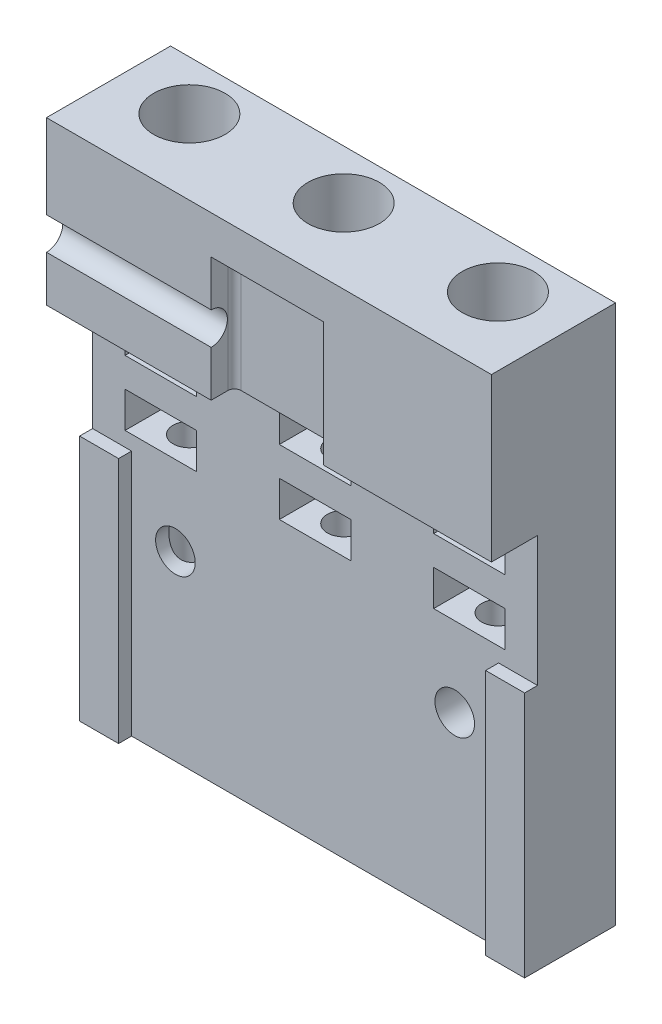
from build123d import *

# Parameters (mm, degrees)
ESQUISSE2_W                  = 56.5
ESQUISSE2_H                  = 38
ESQUISSE2_R                  = 3.05
ESQUISSE2_W_2                = 6
SOCLESYRINGE_DEPTH           = 12
ESQUISSE2_2_R                = 3.05
BOSS_EXTRU_2_DEPTH           = 3
ESQUISSE2_4_W                = 6
ESQUISSE2_4_H                = 38
BOSS_EXTRU_4_DEPTH           = 14
ESQUISSE3_W                  = 68.5
ESQUISSE3_H                  = 20
BOSS_EXTRU_3_DEPTH           = 12
ESQUISSE4_W                  = 11
ESQUISSE4_H                  = 5.5
ENL_V_MAT_EXTRU_1_DEPTH      = 10
CONG_1_R                     = 2.7
ESQUISSE6_W                  = 68.5
ESQUISSE6_H                  = 25
BOSS_EXTRU_5_DEPTH           = 15.5
BOSS_EXTRU_6_DEPTH           = 3.6
ENL_V_MAT_EXTRU_3_DEPTH      = 80.515611675
CONG_2_R                     = 1
ENL_V_MAT_EXTRU_2_DEPTH      = 76.059126694
ENL_V_MAT_EXTRU_2_DEPTH_BACK = 76.059126694
ESQUISSE5_R                  = 2.5
ESQUISSE9_R                  = 5.5
ENL_V_MAT_EXTRU_4_DEPTH      = 24


with BuildPart() as part:
    # Esquisse2 → SocleSyringe (new body)
    # profile 1 of 3: a face of its own
    with BuildSketch(Plane.XY):
        Rectangle(ESQUISSE2_W, ESQUISSE2_H)
        with Locations((-21.5, 9)):
            Circle(ESQUISSE2_R, mode=Mode.SUBTRACT)
        with Locations((21.5, 9)):
            Circle(ESQUISSE2_R, mode=Mode.SUBTRACT)
    # profile 2 of 3: a face of its own
    with BuildSketch(Plane.XY):
        with Locations((-31.25, 0)):
            Rectangle(ESQUISSE2_W_2, ESQUISSE2_H)
    # profile 3 of 3: a face of its own
    with BuildSketch(Plane.XY):
        with Locations((31.25, 0)):
            Rectangle(ESQUISSE2_W_2, ESQUISSE2_H)
    extrude(amount=SOCLESYRINGE_DEPTH)

    # Esquisse2<2> → Boss.-Extru.2 (add)
    with BuildSketch(Plane.XY):
        with Locations((-21.5, 9)):
            Circle(ESQUISSE2_2_R)
        with Locations((21.5, 9)):
            Circle(ESQUISSE2_2_R)
    extrude(amount=BOSS_EXTRU_2_DEPTH)

    # Esquisse2<4> → Boss.-Extru.4 (add)
    with BuildSketch(Plane.XY):
        with Locations((-31.25, 0)):
            Rectangle(ESQUISSE2_4_W, ESQUISSE2_4_H)
        with Locations((31.25, 0)):
            Rectangle(ESQUISSE2_4_W, ESQUISSE2_4_H)
    extrude(amount=BOSS_EXTRU_4_DEPTH)

    # Esquisse3 → Boss.-Extru.3 (add)
    with BuildSketch(Plane.XY):
        with Locations((0, 29)):
            Rectangle(ESQUISSE3_W, ESQUISSE3_H)
    extrude(amount=BOSS_EXTRU_3_DEPTH)

    # Esquisse4 → Enlèv. mat.-Extru.1 (cut)
    with BuildSketch(Plane.XY.offset(12)):
        with Locations((-23.75, 34)):
            Rectangle(ESQUISSE4_W, ESQUISSE4_H)
        with Locations((23.75, 34)):
            Rectangle(ESQUISSE4_W, ESQUISSE4_H)
        with Locations((23.75, 24)):
            Rectangle(ESQUISSE4_W, ESQUISSE4_H)
        with Locations((-23.75, 24)):
            Rectangle(ESQUISSE4_W, ESQUISSE4_H)
        with Locations((0, 34)):
            Rectangle(ESQUISSE4_W, ESQUISSE4_H)
        with Locations((0, 24)):
            Rectangle(ESQUISSE4_W, ESQUISSE4_H)
    extrude(amount=-ENL_V_MAT_EXTRU_1_DEPTH, mode=Mode.SUBTRACT)

    # Congé1
    cong_1_edges = [part.edges().sort_by_distance(p)[0] for p in [
        (23.75, 36.75, 2),
        (23.75, 31.25, 2),
        (23.75, 26.75, 2),
        (23.75, 21.25, 2),
        (-23.75, 21.25, 2),
        (-23.75, 26.75, 2),
        (0, 31.25, 2),
        (0, 36.75, 2),
        (0, 21.25, 2),
        (0, 26.75, 2),
        (-23.75, 31.25, 2),
        (-23.75, 36.75, 2),
    ]]
    fillet(cong_1_edges, radius=CONG_1_R)

    # Esquisse6 → Boss.-Extru.5 (add)
    with BuildSketch(Plane.XY):
        with Locations((0, 51.5)):
            Rectangle(ESQUISSE6_W, ESQUISSE6_H)
    extrude(amount=BOSS_EXTRU_5_DEPTH)

    # Esquisse7 → Boss.-Extru.6 (add)
    with BuildSketch(Plane.XY.offset(15.5)):
        Polygon((-34.25, 39), (-8.9, 39), (-8.9, 58.1), (0, 58.1), (0, 64), (-34.25, 64), align=None)
        Polygon((8.4, 58.1), (8.4, 39), (34.25, 39), (34.25, 64), (0, 64), (0, 58.1), align=None)
    extrude(amount=BOSS_EXTRU_6_DEPTH)

    # Esquisse8 → Enlèv. mat.-Extru.3 (cut, through all)
    with BuildSketch(Plane(origin=(-8.9, 0, 0), x_dir=(0, 0, -1), z_dir=(1, 0, 0))):
        with BuildLine():
            Line((-19.1, 51.05), (-19.1, 46.05))
            ThreePointArc((-19.1, 46.05), (-16.6, 48.55), (-19.1, 51.05))
        make_face()
    extrude(amount=-ENL_V_MAT_EXTRU_3_DEPTH, mode=Mode.SUBTRACT)

    # Congé2
    cong_2_edges = [part.edges().sort_by_distance(p)[0] for p in [
        (-8.9, 48.55, 15.5),
        (8.4, 48.55, 15.5),
    ]]
    fillet(cong_2_edges, radius=CONG_2_R)

    # Esquisse5 → Enlèv. mat.-Extru.2 (cut, two sides: drawn at the far end of the back side and taken through both)
    with BuildSketch(Plane(origin=(0, 0, 0), x_dir=(1, 0, 0), z_dir=(0, 1, 0)).offset(-ENL_V_MAT_EXTRU_2_DEPTH_BACK)):
        with Locations(Location((23.75, -7.6, 0), (0, 0, 270))):
            Circle(ESQUISSE5_R)
        with Locations((-23.75, -7.6)):
            Circle(ESQUISSE5_R)
        with Locations(Location((0, -7.6, 0), (0, 0, 90))):
            Circle(ESQUISSE5_R)
    extrude(amount=ENL_V_MAT_EXTRU_2_DEPTH + ENL_V_MAT_EXTRU_2_DEPTH_BACK, mode=Mode.SUBTRACT)

    # Esquisse9 → Enlèv. mat.-Extru.4 (cut)
    with BuildSketch(Plane(origin=(0, 64, 0), x_dir=(1, 0, 0), z_dir=(0, 1, 0))):
        with Locations(Location((-23.75, -7.6, 0), (0, 0, 270))):
            Circle(ESQUISSE9_R)
        with Locations(Location((0, -7.6, 0), (0, 0, 270))):
            Circle(ESQUISSE9_R)
        with Locations(Location((23.75, -7.6, 0), (0, 0, 270))):
            Circle(ESQUISSE9_R)
    extrude(amount=-ENL_V_MAT_EXTRU_4_DEPTH, mode=Mode.SUBTRACT)


solid = part.part
